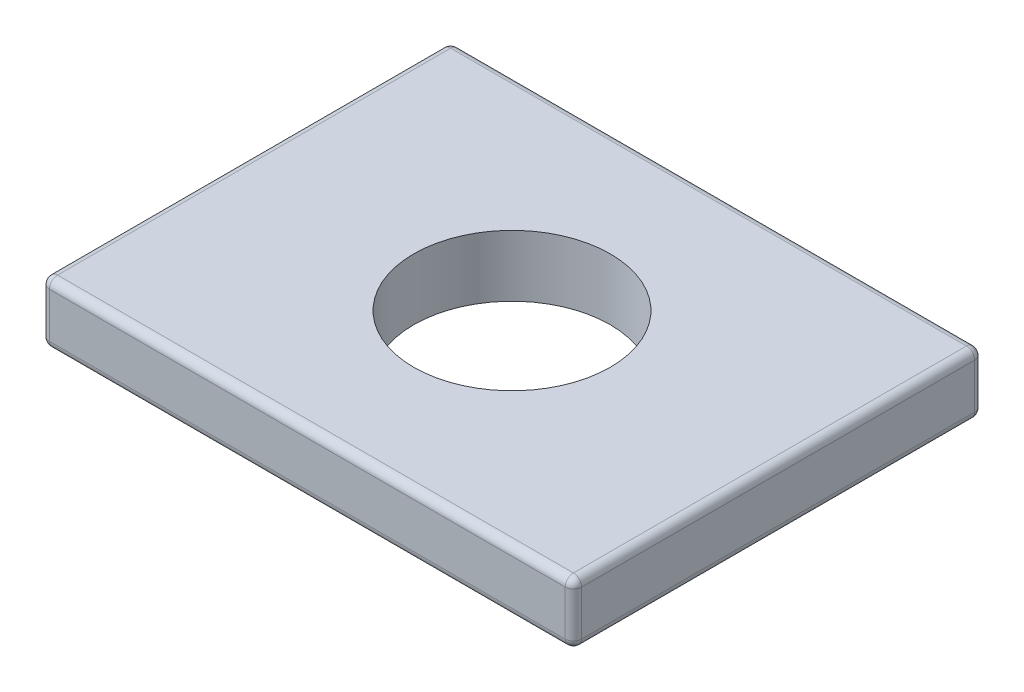
from build123d import *

# Parameters (mm, degrees)
SKETCH1_W                = 6.5
SKETCH1_H                = 5
BOSS_EXTRUDE1_DEPTH      = 0.75
M2_CLEARANCE_HOLE1_D     = 2.4
M2_CLEARANCE_HOLE1_DEPTH = 1.6
M2_CLEARANCE_HOLE1_TIP   = 0.721032743
FILLET1_R                = 0.1


with BuildPart() as part:
    # Sketch1 → Boss-Extrude1 (new body)
    with BuildSketch(Plane(origin=(0, 0, 0), x_dir=(1, 0, 0), z_dir=(0, 1, 0))):
        Rectangle(SKETCH1_W, SKETCH1_H)
    extrude(amount=BOSS_EXTRUDE1_DEPTH)

    # M2 Clearance Hole1
    with Locations(Plane(origin=(0, 0.75, 0), x_dir=(1, 0, 0), z_dir=(0, 1, 0))):
        with Locations((0, 0)):
            Hole(M2_CLEARANCE_HOLE1_D / 2, depth=M2_CLEARANCE_HOLE1_DEPTH)
            with Locations((0, 0, -(M2_CLEARANCE_HOLE1_DEPTH + M2_CLEARANCE_HOLE1_TIP / 2))):  # 118° drill point
                Cone(0, M2_CLEARANCE_HOLE1_D / 2, M2_CLEARANCE_HOLE1_TIP, mode=Mode.SUBTRACT)

    # Fillet1
    fillet1_edges = [part.edges().sort_by_distance(p)[0] for p in [
        (3.25, 0.75, 0),
        (0, 0.75, -2.5),
        (-3.25, 0.75, 0),
        (0, 0, -2.5),
        (3.25, 0, 0),
        (0, 0, 2.5),
        (-3.25, 0, 0),
        (-3.25, 0.375, -2.5),
        (3.25, 0.375, -2.5),
        (3.25, 0.375, 2.5),
        (-3.25, 0.375, 2.5),
        (0, 0.75, 2.5),
    ]]
    fillet(fillet1_edges, radius=FILLET1_R)


solid = part.part
